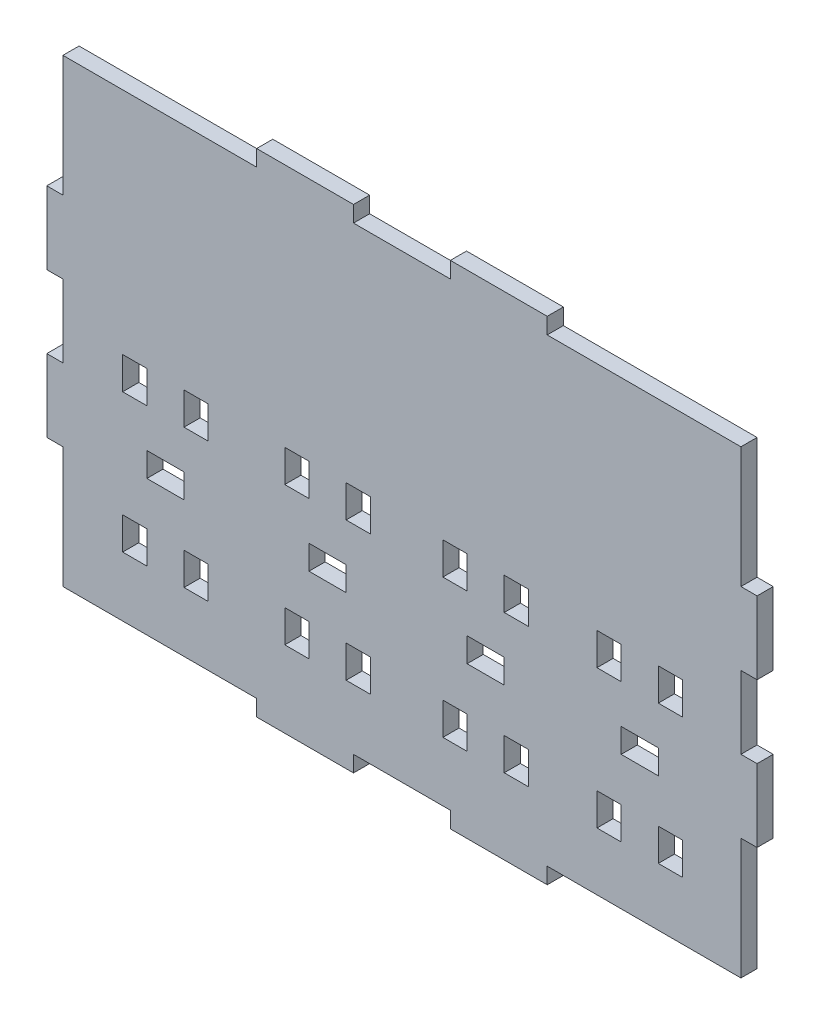
from build123d import *

# Parameters (mm, degrees)
SKETCH2_W           = 15
SKETCH2_H           = 20
SKETCH2_W_2         = 23
SKETCH2_H_2         = 15
BOSS_EXTRUDE1_DEPTH = 10


with BuildPart() as part:
    # Sketch2 → Boss-Extrude1 (new body)
    with BuildSketch(Plane.XY):
        Polygon((0, 0), (120, 0), (120, 10), (180, 10), (180, 0), (240, 0), (240, 10), (300, 10), (300, 0), (420, 0), (420, -75), (430, -75), (430, -120), (420, -120), (420, -165), (430, -165), (430, -210), (420, -210), (420, -285), (300, -285), (300, -295), (240, -295), (240, -285), (180, -285), (180, -295), (120, -295), (120, -285), (0, -285), (0, -210), (-10, -210), (-10, -165), (0, -165), (0, -120), (-10, -120), (-10, -75), (0, -75), align=None)
        with Locations((144.916665259, -151.561421388)):
            Rectangle(SKETCH2_W, SKETCH2_H, mode=Mode.SUBTRACT)
        with Locations((338.315226992, -153.118682745)):
            Rectangle(SKETCH2_W, SKETCH2_H, mode=Mode.SUBTRACT)
        with Locations((376.315226992, -153.118682745)):
            Rectangle(SKETCH2_W, SKETCH2_H, mode=Mode.SUBTRACT)
        with Locations((338.315226992, -239.118682745)):
            Rectangle(SKETCH2_W, SKETCH2_H, mode=Mode.SUBTRACT)
        with Locations((44.5, -152)):
            Rectangle(SKETCH2_W, SKETCH2_H, mode=Mode.SUBTRACT)
        with Locations((82.5, -152)):
            Rectangle(SKETCH2_W, SKETCH2_H, mode=Mode.SUBTRACT)
        with Locations((44.5, -238)):
            Rectangle(SKETCH2_W, SKETCH2_H, mode=Mode.SUBTRACT)
        with Locations((82.5, -238)):
            Rectangle(SKETCH2_W, SKETCH2_H, mode=Mode.SUBTRACT)
        with Locations((63.5, -193.5)):
            Rectangle(SKETCH2_W_2, SKETCH2_H_2, mode=Mode.SUBTRACT)
        with Locations((182.916665259, -151.561421388)):
            Rectangle(SKETCH2_W, SKETCH2_H, mode=Mode.SUBTRACT)
        with Locations((144.916665259, -237.561421388)):
            Rectangle(SKETCH2_W, SKETCH2_H, mode=Mode.SUBTRACT)
        with Locations((182.916665259, -237.561421388)):
            Rectangle(SKETCH2_W, SKETCH2_H, mode=Mode.SUBTRACT)
        with Locations((163.916665259, -193.061421388)):
            Rectangle(SKETCH2_W_2, SKETCH2_H_2, mode=Mode.SUBTRACT)
        with Locations((242.869049507, -152.216184795)):
            Rectangle(SKETCH2_W, SKETCH2_H, mode=Mode.SUBTRACT)
        with Locations((280.869049507, -152.216184795)):
            Rectangle(SKETCH2_W, SKETCH2_H, mode=Mode.SUBTRACT)
        with Locations((242.869049507, -238.216184795)):
            Rectangle(SKETCH2_W, SKETCH2_H, mode=Mode.SUBTRACT)
        with Locations((280.869049507, -238.216184795)):
            Rectangle(SKETCH2_W, SKETCH2_H, mode=Mode.SUBTRACT)
        with Locations((261.869049507, -193.716184795)):
            Rectangle(SKETCH2_W_2, SKETCH2_H_2, mode=Mode.SUBTRACT)
        with Locations((376.315226992, -239.118682745)):
            Rectangle(SKETCH2_W, SKETCH2_H, mode=Mode.SUBTRACT)
        with Locations((357.315226992, -194.618682745)):
            Rectangle(SKETCH2_W_2, SKETCH2_H_2, mode=Mode.SUBTRACT)
    extrude(amount=BOSS_EXTRUDE1_DEPTH)


solid = part.part
